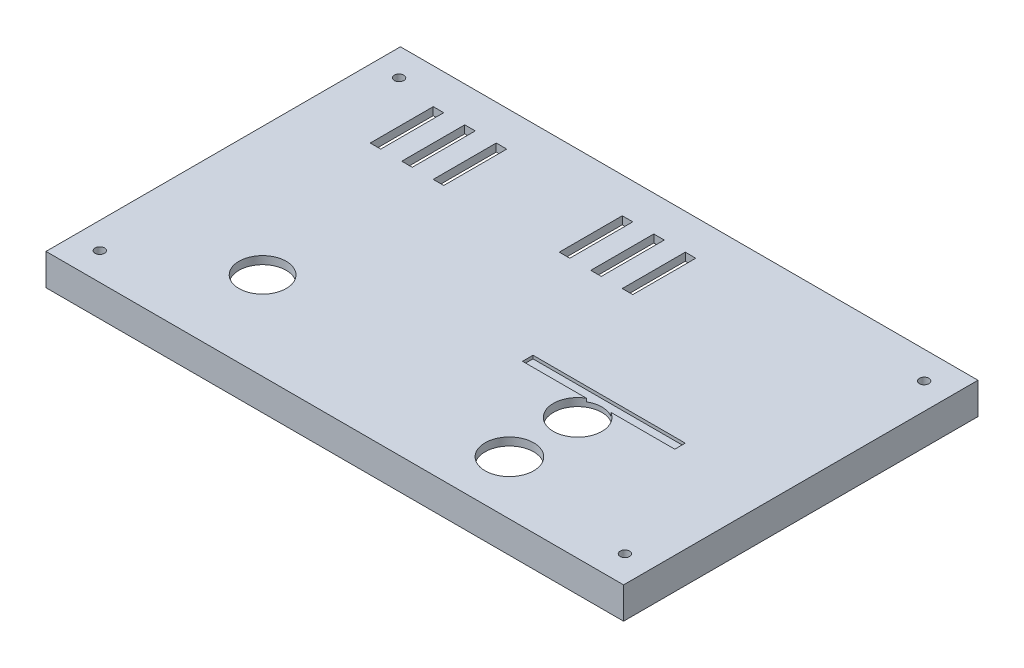
from build123d import *

# Parameters (mm, degrees)
SKETCH_1_W                       = 220
SKETCH_1_H                       = 135
LID_TOP_3MM_DEPTH                = 3
SKETCH_2_W                       = 216
SKETCH_2_H                       = 2
LID_RIM_BACK_DEPTH               = 12
SKETCH_3_W                       = 216
SKETCH_3_H                       = 2
LID_RIM_FRONT_DEPTH              = 12
SKETCH_4_W                       = 2
SKETCH_4_H                       = 135
LID_RIM_LEFT_DEPTH               = 12
SKETCH_5_W                       = 2
SKETCH_5_H                       = 135
LID_RIM_RIGHT_DEPTH              = 12
SKETCH_6_R                       = 1.8
LID_SCREW_CLEARANCE_1_DEPTH      = 16
SKETCH_7_R                       = 1.8
LID_SCREW_CLEARANCE_2_DEPTH      = 16
SKETCH_8_R                       = 1.8
LID_SCREW_CLEARANCE_3_DEPTH      = 16
SKETCH_9_R                       = 1.8
LID_SCREW_CLEARANCE_4_DEPTH      = 16
SKETCH_10_R                      = 9
OV5647_LENS_OPENING_D18_DEPTH    = 4
SKETCH_11_R                      = 9.25
HC_SR04_ACOUSTIC_OPENING_1_DEPTH = 4
SKETCH_12_R                      = 9.25
HC_SR04_ACOUSTIC_OPENING_2_DEPTH = 4
SKETCH_13_W                      = 58
SKETCH_13_H                      = 4
HC_SR04_ALIGNMENT_RECESS_DEPTH   = 1.2
SKETCH_14_W                      = 4
SKETCH_14_H                      = 24
VENT_SLOT_1_DEPTH                = 4
SKETCH_15_W                      = 4
SKETCH_15_H                      = 24
VENT_SLOT_2_DEPTH                = 4
SKETCH_16_W                      = 4
SKETCH_16_H                      = 24
VENT_SLOT_3_DEPTH                = 4
SKETCH_17_W                      = 4
SKETCH_17_H                      = 24
VENT_SLOT_4_DEPTH                = 4
SKETCH_18_W                      = 4
SKETCH_18_H                      = 24
VENT_SLOT_5_DEPTH                = 4
SKETCH_19_W                      = 4
SKETCH_19_H                      = 24
VENT_SLOT_6_DEPTH                = 4


with BuildPart() as part:
    # 草图1 → Lid_Top_3mm (new body)
    with BuildSketch(Plane(origin=(0, 0, 0), x_dir=(1, 0, 0), z_dir=(0, 1, 0))):
        Rectangle(SKETCH_1_W, SKETCH_1_H)
    extrude(amount=-LID_TOP_3MM_DEPTH)

    # 草图2 → Lid_Rim_Back (add)
    with BuildSketch(Plane(origin=(0, 0, 0), x_dir=(1, 0, 0), z_dir=(0, 1, 0))):
        with Locations((0, 66.5)):
            Rectangle(SKETCH_2_W, SKETCH_2_H)
    extrude(amount=-LID_RIM_BACK_DEPTH)

    # 草图3 → Lid_Rim_Front (add)
    with BuildSketch(Plane(origin=(0, 0, 0), x_dir=(1, 0, 0), z_dir=(0, 1, 0))):
        with Locations((0, -66.5)):
            Rectangle(SKETCH_3_W, SKETCH_3_H)
    extrude(amount=-LID_RIM_FRONT_DEPTH)

    # 草图4 → Lid_Rim_Left (add)
    with BuildSketch(Plane(origin=(0, 0, 0), x_dir=(1, 0, 0), z_dir=(0, 1, 0))):
        with Locations((-109, 0)):
            Rectangle(SKETCH_4_W, SKETCH_4_H)
    extrude(amount=-LID_RIM_LEFT_DEPTH)

    # 草图5 → Lid_Rim_Right (add)
    with BuildSketch(Plane(origin=(0, 0, 0), x_dir=(1, 0, 0), z_dir=(0, 1, 0))):
        with Locations((109, 0)):
            Rectangle(SKETCH_5_W, SKETCH_5_H)
    extrude(amount=-LID_RIM_RIGHT_DEPTH)

    # 草图6 → Lid_Screw_Clearance_1 (cut)
    with BuildSketch(Plane(origin=(0, 0, 0), x_dir=(1, 0, 0), z_dir=(0, 1, 0))):
        with Locations(Location((-100, -57, 0), (0, 0, 270))):
            Circle(SKETCH_6_R)
    extrude(amount=-LID_SCREW_CLEARANCE_1_DEPTH, mode=Mode.SUBTRACT)

    # 草图7 → Lid_Screw_Clearance_2 (cut)
    with BuildSketch(Plane(origin=(0, 0, 0), x_dir=(1, 0, 0), z_dir=(0, 1, 0))):
        with Locations(Location((100, -57, 0), (0, 0, 270))):
            Circle(SKETCH_7_R)
    extrude(amount=-LID_SCREW_CLEARANCE_2_DEPTH, mode=Mode.SUBTRACT)

    # 草图8 → Lid_Screw_Clearance_3 (cut)
    with BuildSketch(Plane(origin=(0, 0, 0), x_dir=(1, 0, 0), z_dir=(0, 1, 0))):
        with Locations(Location((-100, 57, 0), (0, 0, 270))):
            Circle(SKETCH_8_R)
    extrude(amount=-LID_SCREW_CLEARANCE_3_DEPTH, mode=Mode.SUBTRACT)

    # 草图9 → Lid_Screw_Clearance_4 (cut)
    with BuildSketch(Plane(origin=(0, 0, 0), x_dir=(1, 0, 0), z_dir=(0, 1, 0))):
        with Locations(Location((100, 57, 0), (0, 0, 270))):
            Circle(SKETCH_9_R)
    extrude(amount=-LID_SCREW_CLEARANCE_4_DEPTH, mode=Mode.SUBTRACT)

    # 草图10 → OV5647_Lens_Opening_D18 (cut)
    with BuildSketch(Plane(origin=(0, 0, 0), x_dir=(1, 0, 0), z_dir=(0, 1, 0))):
        with Locations(Location((-61, -34, 0), (0, 0, 270))):
            Circle(SKETCH_10_R)
    extrude(amount=-OV5647_LENS_OPENING_D18_DEPTH, mode=Mode.SUBTRACT)

    # 草图11 → HC_SR04_Acoustic_Opening_1 (cut)
    with BuildSketch(Plane(origin=(0, 0, 0), x_dir=(1, 0, 0), z_dir=(0, 1, 0))):
        with Locations(Location((46, -47, 0), (0, 0, 270))):
            Circle(SKETCH_11_R)
    extrude(amount=-HC_SR04_ACOUSTIC_OPENING_1_DEPTH, mode=Mode.SUBTRACT)

    # 草图12 → HC_SR04_Acoustic_Opening_2 (cut)
    with BuildSketch(Plane(origin=(0, 0, 0), x_dir=(1, 0, 0), z_dir=(0, 1, 0))):
        with Locations(Location((46, -21, 0), (0, 0, 270))):
            Circle(SKETCH_12_R)
    extrude(amount=-HC_SR04_ACOUSTIC_OPENING_2_DEPTH, mode=Mode.SUBTRACT)

    # 草图13 → HC_SR04_Alignment_Recess (cut)
    with BuildSketch(Plane(origin=(0, 0, 0), x_dir=(1, 0, 0), z_dir=(0, 1, 0))):
        with Locations((46, -11)):
            Rectangle(SKETCH_13_W, SKETCH_13_H)
    extrude(amount=-HC_SR04_ALIGNMENT_RECESS_DEPTH, mode=Mode.SUBTRACT)

    # 草图14 → Vent_Slot_1 (cut)
    with BuildSketch(Plane(origin=(0, 0, 0), x_dir=(1, 0, 0), z_dir=(0, 1, 0))):
        with Locations((-82, 42)):
            Rectangle(SKETCH_14_W, SKETCH_14_H)
    extrude(amount=-VENT_SLOT_1_DEPTH, mode=Mode.SUBTRACT)

    # 草图15 → Vent_Slot_2 (cut)
    with BuildSketch(Plane(origin=(0, 0, 0), x_dir=(1, 0, 0), z_dir=(0, 1, 0))):
        with Locations((-70, 42)):
            Rectangle(SKETCH_15_W, SKETCH_15_H)
    extrude(amount=-VENT_SLOT_2_DEPTH, mode=Mode.SUBTRACT)

    # 草图16 → Vent_Slot_3 (cut)
    with BuildSketch(Plane(origin=(0, 0, 0), x_dir=(1, 0, 0), z_dir=(0, 1, 0))):
        with Locations((-58, 42)):
            Rectangle(SKETCH_16_W, SKETCH_16_H)
    extrude(amount=-VENT_SLOT_3_DEPTH, mode=Mode.SUBTRACT)

    # 草图17 → Vent_Slot_4 (cut)
    with BuildSketch(Plane(origin=(0, 0, 0), x_dir=(1, 0, 0), z_dir=(0, 1, 0))):
        with Locations((-10, 42)):
            Rectangle(SKETCH_17_W, SKETCH_17_H)
    extrude(amount=-VENT_SLOT_4_DEPTH, mode=Mode.SUBTRACT)

    # 草图18 → Vent_Slot_5 (cut)
    with BuildSketch(Plane(origin=(0, 0, 0), x_dir=(1, 0, 0), z_dir=(0, 1, 0))):
        with Locations((2, 42)):
            Rectangle(SKETCH_18_W, SKETCH_18_H)
    extrude(amount=-VENT_SLOT_5_DEPTH, mode=Mode.SUBTRACT)

    # 草图19 → Vent_Slot_6 (cut)
    with BuildSketch(Plane(origin=(0, 0, 0), x_dir=(1, 0, 0), z_dir=(0, 1, 0))):
        with Locations((14, 42)):
            Rectangle(SKETCH_19_W, SKETCH_19_H)
    extrude(amount=-VENT_SLOT_6_DEPTH, mode=Mode.SUBTRACT)


solid = part.part
